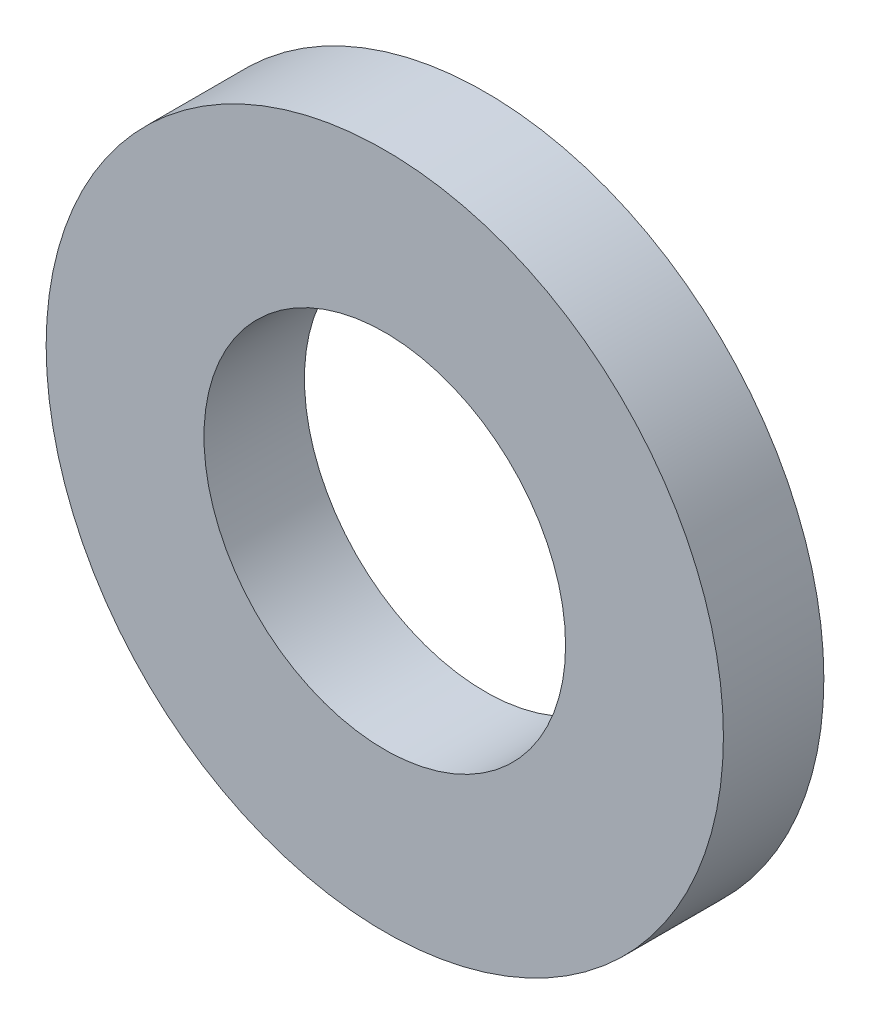
from build123d import *

# Parameters (mm, degrees)
BOSS_EXTRUDE1_DEPTH      = 0.889
BOSS_EXTRUDE1_DEPTH_BACK = 0.889
SKETCH3_R                = 5.9944
SKETCH3_R_2              = 3.2004


with BuildPart() as part:
    # Sketch3 → Boss-Extrude1 (new, two sides: drawn at the far end of the back side and taken through both)
    with BuildSketch(Plane.XY.offset(-BOSS_EXTRUDE1_DEPTH_BACK)):
        Circle(SKETCH3_R)
        Circle(SKETCH3_R_2, mode=Mode.SUBTRACT)
    extrude(amount=BOSS_EXTRUDE1_DEPTH + BOSS_EXTRUDE1_DEPTH_BACK)


solid = part.part
